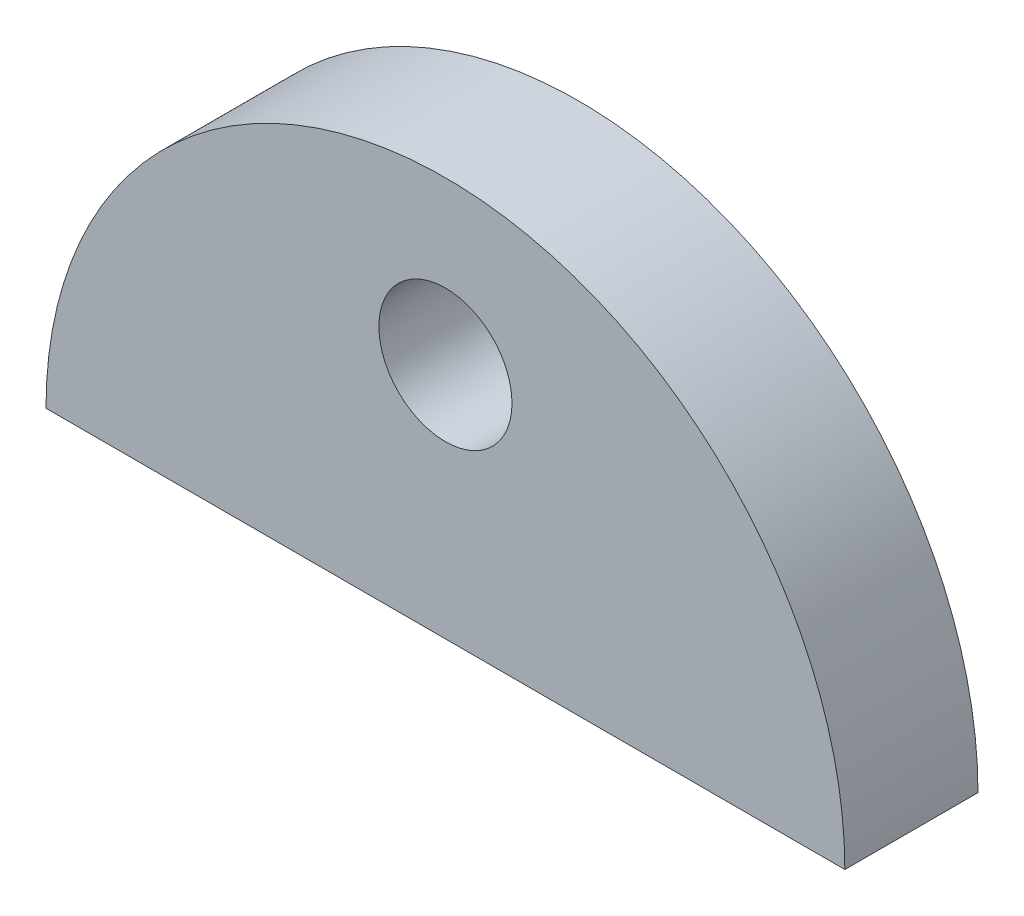
from build123d import *

# Parameters (mm, degrees)
SKETCH2_R           = 3.175
BOSS_EXTRUDE1_DEPTH = 6.35
SCALE1_SCALE        = 1.5


with BuildPart() as part:
    # Sketch2 → Boss-Extrude1 (new body)
    with BuildSketch(Plane.XY):
        with BuildLine():
            Line((-38.1, 0), (0, 0))
            ThreePointArc((0, 0), (-19.05, 19.05), (-38.1, 0))
        make_face()
        with Locations((-19.05, 11.320090227)):
            Circle(SKETCH2_R, mode=Mode.SUBTRACT)
    extrude(amount=BOSS_EXTRUDE1_DEPTH)


with BuildPart() as part_1:
    # Scale1: scaled about (-19.05, 7.894775867, 3.175)
    add(part.part.scale(SCALE1_SCALE).moved(Location((9.525, -3.947387933, -1.5875))))


solid = part_1.part
